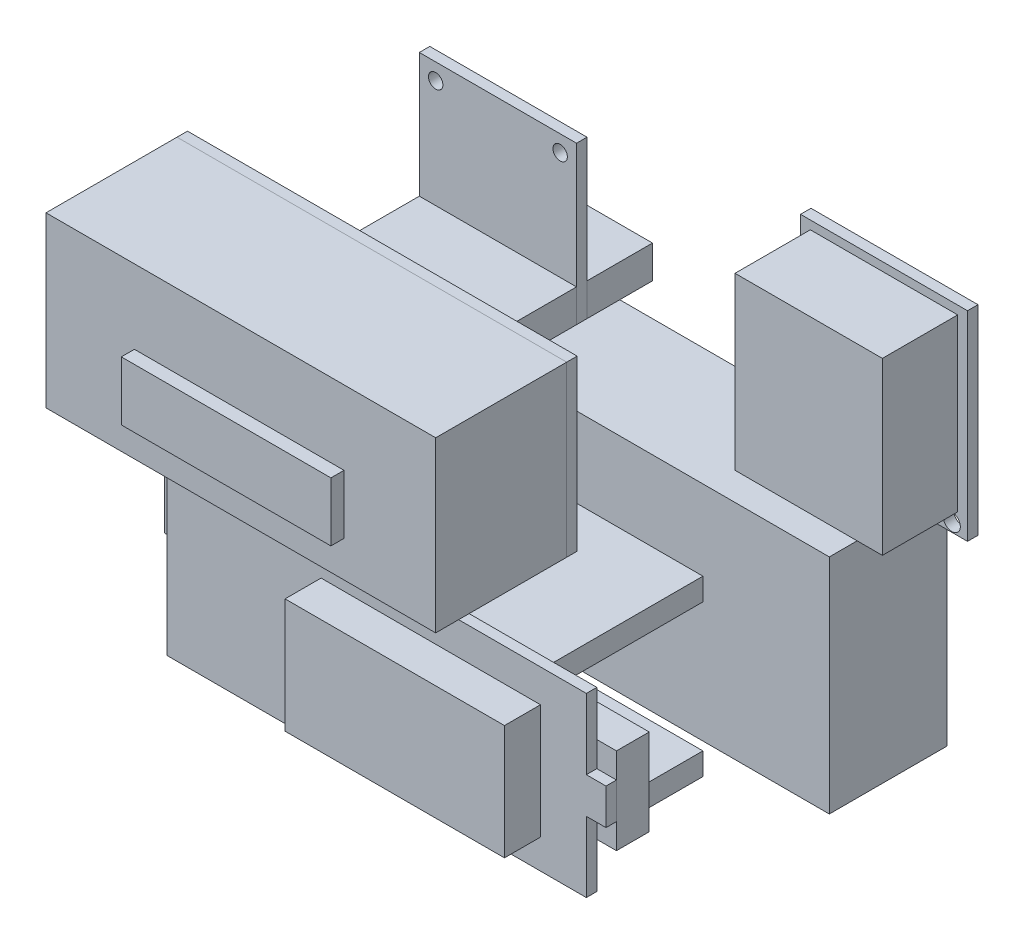
from build123d import *

# Parameters (mm, degrees)
EXTRUDE_START           = 4
PROFILE_W               = 69
PROFILE_H               = 34
EXTRUDE_469_DEPTH       = 18
EXTRUDE_START_2         = 14
F_24_24_2_2_PROFILE_W   = 24
F_24_24_2_2_PROFILE_H   = 24
F_24_24_2_2_PROFILE_R   = 1.1
EXTRUDE_24_24_2_2_DEPTH = 1.6
F_5MM_10MM_START        = 4
F_5MM_10MM_PROFILE_W    = 24
F_5MM_10MM_PROFILE_H    = 5
F_5MM_10MM_DEPTH        = 10
F_5MM_START             = 15.6
F_5MM_PROFILE_W         = 24
F_5MM_PROFILE_H         = 5
F_5MM_DEPTH             = 23
GNSS_3MM_2_6_START      = 8.8
GNSS_3MM_2_6_PROFILE_W  = 25.5
GNSS_3MM_2_6_PROFILE_H  = 30.5
GNSS_3MM_2_6_PROFILE_R  = 1.3
GNSS_3MM_2_6_DEPTH      = 1.6
GNSS_11_5MM_START       = 10.4
GNSS_11_5MM_PROFILE_W   = 22.5
GNSS_11_5MM_PROFILE_H   = 26.05
GNSS_11_5MM_DEPTH       = 11.5
GNSS_START              = 4.3
GNSS_PROFILE_W          = 8
GNSS_PROFILE_H          = 6.45
GNSS_DEPTH              = 4.5
EXTRUDE_START_3         = 44
PROFILE_2_W             = 59.5
PROFILE_2_H             = 25.8
PROFILE_2_R             = 1.5
EXTRUDE_907_DEPTH       = 1.6
F_20MM_START            = 45.6
F_20MM_PROFILE_W        = 59.5
F_20MM_PROFILE_H        = 25.8
F_20MM_DEPTH            = 20
F_20MM_START_2          = 65.6
F_20MM_PROFILE_2_W      = 32
F_20MM_PROFILE_2_H      = 9
F_20MM_2_DEPTH          = 2
EORA_START              = 55
EORA_DEPTH              = 1.6
EORA_5_5MM_START        = 56.6
EORA_5_5MM_PROFILE_W    = 33.5
EORA_5_5MM_PROFILE_H    = 17.5
EORA_5_5MM_DEPTH        = 5.5
EORA_START_2            = 32
EORA_PROFILE_2_W        = 35.7
EORA_PROFILE_2_H        = 3.4
EORA_2_DEPTH            = 23
EORA_PROFILE_3_W        = 35.7
EORA_PROFILE_3_H        = 3.4
EORA_3_DEPTH            = 23
EORA_4MM_START          = 51
EORA_4MM_PROFILE_W      = 7
EORA_4MM_PROFILE_H      = 9.3
EORA_4MM_DEPTH          = 4
EORA_5MM_START          = 50
EORA_5MM_PROFILE_W      = 8
EORA_5MM_PROFILE_H      = 13.2
EORA_5MM_DEPTH          = 5


with BuildPart() as part:
    # profile → Extrude 469 (new body)
    with BuildSketch(Plane.XY.offset(EXTRUDE_START)):
        with Locations((0, -16)):
            Rectangle(PROFILE_W, PROFILE_H)
    extrude(amount=EXTRUDE_469_DEPTH)


with BuildPart() as body_2:
    # 传感器板 24×24，Ø2.2孔 profile → 传感器板 24×24，Ø2.2孔 (new body)
    with BuildSketch(Plane.XY.offset(EXTRUDE_START_2)):
        with Locations((-22.5, 18)):
            Rectangle(F_24_24_2_2_PROFILE_W, F_24_24_2_2_PROFILE_H)
        with Locations((-32, 27.5)):
            Circle(F_24_24_2_2_PROFILE_R, mode=Mode.SUBTRACT)
        with Locations((-13, 27.5)):
            Circle(F_24_24_2_2_PROFILE_R, mode=Mode.SUBTRACT)
    extrude(amount=EXTRUDE_24_24_2_2_DEPTH)


with BuildPart() as body_3:
    # 排针侧5mm，板下按10mm避空 profile → 排针侧5mm，板下按10mm避空 (new body)
    with BuildSketch(Plane.XY.offset(F_5MM_10MM_START)):
        with Locations((-22.5, 8.5)):
            Rectangle(F_5MM_10MM_PROFILE_W, F_5MM_10MM_PROFILE_H)
    extrude(amount=F_5MM_10MM_DEPTH)


with BuildPart() as body_4:
    # 排针侧5mm，板上线头和弯线预留 profile → 排针侧5mm，板上线头和弯线预留 (new body)
    with BuildSketch(Plane.XY.offset(F_5MM_START)):
        with Locations((-22.5, 8.5)):
            Rectangle(F_5MM_PROFILE_W, F_5MM_PROFILE_H)
    extrude(amount=F_5MM_DEPTH)


with BuildPart() as body_5:
    # GNSS板，3mm单边Ø2.6安装区 profile → GNSS板，3mm单边Ø2.6安装区 (new body)
    with BuildSketch(Plane.XY.offset(GNSS_3MM_2_6_START)):
        with Locations((31.25, 17.25)):
            Rectangle(GNSS_3MM_2_6_PROFILE_W, GNSS_3MM_2_6_PROFILE_H)
        with Locations((21.1, 3.4)):
            Circle(GNSS_3MM_2_6_PROFILE_R, mode=Mode.SUBTRACT)
        with Locations((41.6, 3.4)):
            Circle(GNSS_3MM_2_6_PROFILE_R, mode=Mode.SUBTRACT)
    extrude(amount=GNSS_3MM_2_6_DEPTH)


with BuildPart() as body_6:
    # GNSS陶瓷天线面朝上，保留11.5mm profile → GNSS陶瓷天线面朝上，保留11.5mm (new body)
    with BuildSketch(Plane.XY.offset(GNSS_11_5MM_START)):
        with Locations((31.25, 18.175)):
            Rectangle(GNSS_11_5MM_PROFILE_W, GNSS_11_5MM_PROFILE_H)
    extrude(amount=GNSS_11_5MM_DEPTH)


with BuildPart() as body_7:
    # GNSS背面插头预留 profile → GNSS背面插头预留 (new body)
    with BuildSketch(Plane.XY.offset(GNSS_START)):
        with Locations((30, 5.275)):
            Rectangle(GNSS_PROFILE_W, GNSS_PROFILE_H)
    extrude(amount=GNSS_DEPTH)


with BuildPart() as body_8:
    # profile 2 → Extrude 907 (new body)
    with BuildSketch(Plane.XY.offset(EXTRUDE_START_3)):
        with Locations((-11.75, 17.4)):
            Rectangle(PROFILE_2_W, PROFILE_2_H)
        with Locations((-36.75, 8.9)):
            Circle(PROFILE_2_R, mode=Mode.SUBTRACT)
        with Locations((13.25, 8.9)):
            Circle(PROFILE_2_R, mode=Mode.SUBTRACT)
        with Locations((-36.75, 25.9)):
            Circle(PROFILE_2_R, mode=Mode.SUBTRACT)
        with Locations((13.25, 25.9)):
            Circle(PROFILE_2_R, mode=Mode.SUBTRACT)
    extrude(amount=EXTRUDE_907_DEPTH)


with BuildPart() as body_9:
    # 20mm_ profile → 20mm (new body)
    with BuildSketch(Plane.XY.offset(F_20MM_START)):
        with Locations((-11.75, 17.4)):
            Rectangle(F_20MM_PROFILE_W, F_20MM_PROFILE_H)
    extrude(amount=F_20MM_DEPTH)


with BuildPart() as body_10:
    # 20mm_ profile 2 → 20mm 2 (new body)
    with BuildSketch(Plane.XY.offset(F_20MM_START_2)):
        with Locations((-12, 14.5)):
            Rectangle(F_20MM_PROFILE_2_W, F_20MM_PROFILE_2_H)
    extrude(amount=F_20MM_2_DEPTH)


with BuildPart() as body_11:
    # EoRa_ profile → EoRa (new body)
    with BuildSketch(Plane.XY.offset(EORA_START)):
        Polygon((-32, -28), (32, -28), (32, -17.25), (35, -17.25), (35, -11.75), (32, -11.75), (32, -1), (-32, -1), align=None)
    extrude(amount=EORA_DEPTH)


with BuildPart() as body_12:
    # EoRa屏幕5.5mm profile → EoRa屏幕5.5mm (new body)
    with BuildSketch(Plane.XY.offset(EORA_5_5MM_START)):
        with Locations((8.25, -14.75)):
            Rectangle(EORA_5_5MM_PROFILE_W, EORA_5_5MM_PROFILE_H)
    extrude(amount=EORA_5_5MM_DEPTH)


with BuildPart() as body_13:
    # EoRa_ profile 2 → EoRa 2 (new body)
    with BuildSketch(Plane.XY.offset(EORA_START_2)):
        with Locations((7.35, -26)):
            Rectangle(EORA_PROFILE_2_W, EORA_PROFILE_2_H)
    extrude(amount=EORA_2_DEPTH)


with BuildPart() as body_14:
    # EoRa_ profile 3 → EoRa 3 (new body)
    with BuildSketch(Plane.XY.offset(EORA_START_2)):
        with Locations((7.35, -2.9)):
            Rectangle(EORA_PROFILE_3_W, EORA_PROFILE_3_H)
    extrude(amount=EORA_3_DEPTH)


with BuildPart() as body_15:
    # EoRa接口端背面4mm避空 profile → EoRa接口端背面4mm避空 (new body)
    with BuildSketch(Plane.XY.offset(EORA_4MM_START)):
        with Locations((-30.5, -8.95)):
            Rectangle(EORA_4MM_PROFILE_W, EORA_4MM_PROFILE_H)
    extrude(amount=EORA_4MM_DEPTH)


with BuildPart() as body_16:
    # EoRa另一端背面5mm避空 profile → EoRa另一端背面5mm避空 (new body)
    with BuildSketch(Plane.XY.offset(EORA_5MM_START)):
        with Locations((31, -14.5)):
            Rectangle(EORA_5MM_PROFILE_W, EORA_5MM_PROFILE_H)
    extrude(amount=EORA_5MM_DEPTH)


solid = Compound([part.part, body_2.part, body_3.part, body_4.part, body_5.part, body_6.part, body_7.part, body_8.part, body_9.part, body_10.part, body_11.part, body_12.part, body_13.part, body_14.part, body_15.part, body_16.part])
